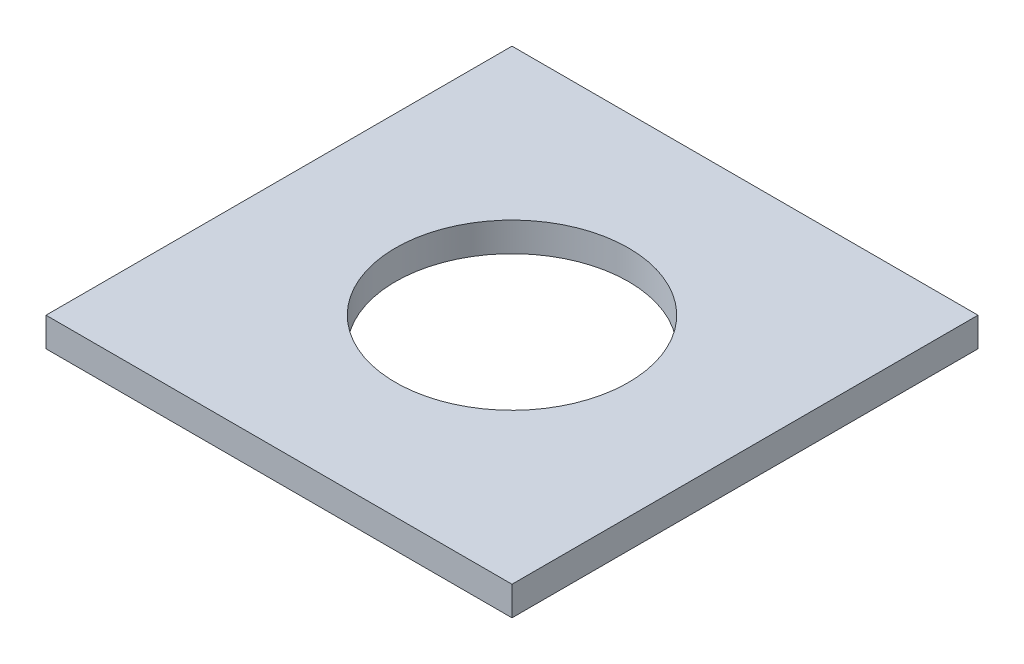
from build123d import *

# Parameters (mm, degrees)
SKETCH1_W           = 152.4
SKETCH1_H           = 152.4
SKETCH1_R           = 38.1
BOSS_EXTRUDE1_DEPTH = 9.525


with BuildPart() as part:
    # Sketch1 → Boss-Extrude1 (new body)
    with BuildSketch(Plane(origin=(0, 0, 0), x_dir=(1, 0, 0), z_dir=(0, 1, 0))):
        Rectangle(SKETCH1_W, SKETCH1_H)
        with Locations(Location((0, 0, 0), (0, 0, 90))):
            Circle(SKETCH1_R, mode=Mode.SUBTRACT)
    extrude(amount=BOSS_EXTRUDE1_DEPTH)


solid = part.part
